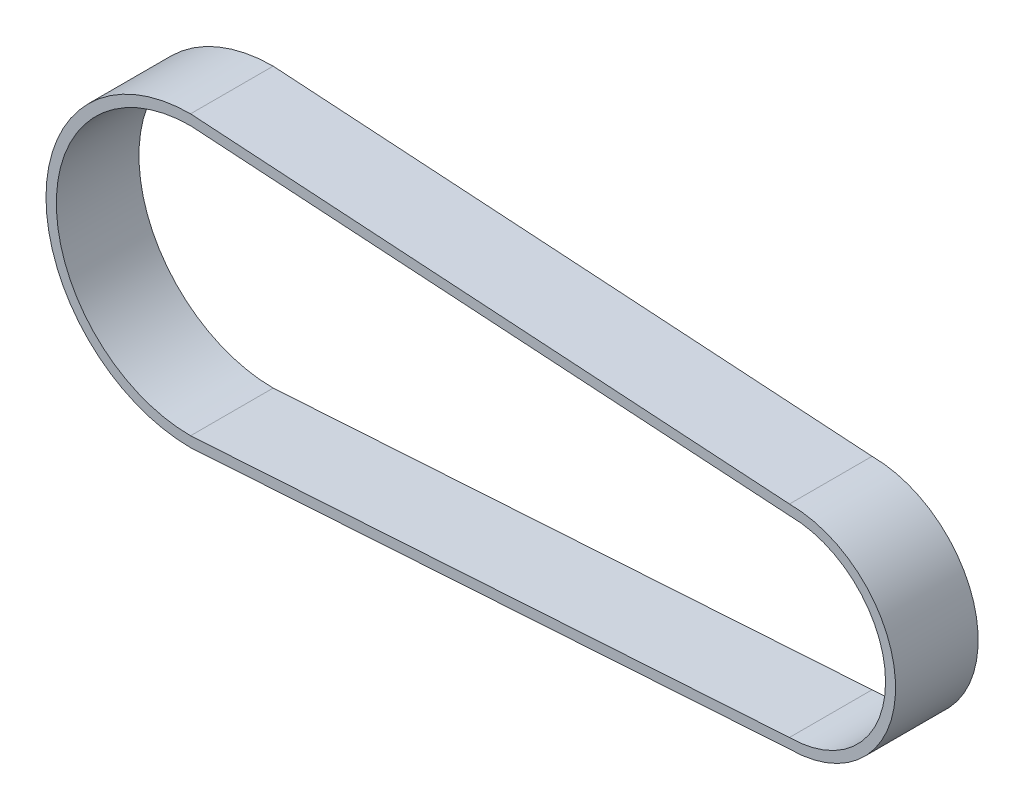
from build123d import *

# Parameters (mm, degrees)
BOSS_EXTRU_1_DEPTH = 8


with BuildPart() as part:
    # Esquisse1 → Boss.-Extru.1 (new body)
    with BuildSketch(Plane.XY):
        with BuildLine():
            Line((-33, -14), (25, -10.276071075))
            ThreePointArc((25, -10.276071075), (35.276071075, 0), (25, 10.276071075))
            Line((25, 10.276071075), (-33, 14))
            ThreePointArc((-33, 14), (-47, 0), (-33, -14))
        make_face()
        with BuildLine():
            Line((-33, -13), (25, -9.305785122))
            ThreePointArc((25, -9.305785122), (34.305785122, 0), (25, 9.305785122))
            Line((25, 9.305785122), (-33, 13))
            ThreePointArc((-33, 13), (-46, 0), (-33, -13))
        make_face(mode=Mode.SUBTRACT)
    extrude(amount=BOSS_EXTRU_1_DEPTH)


solid = part.part
